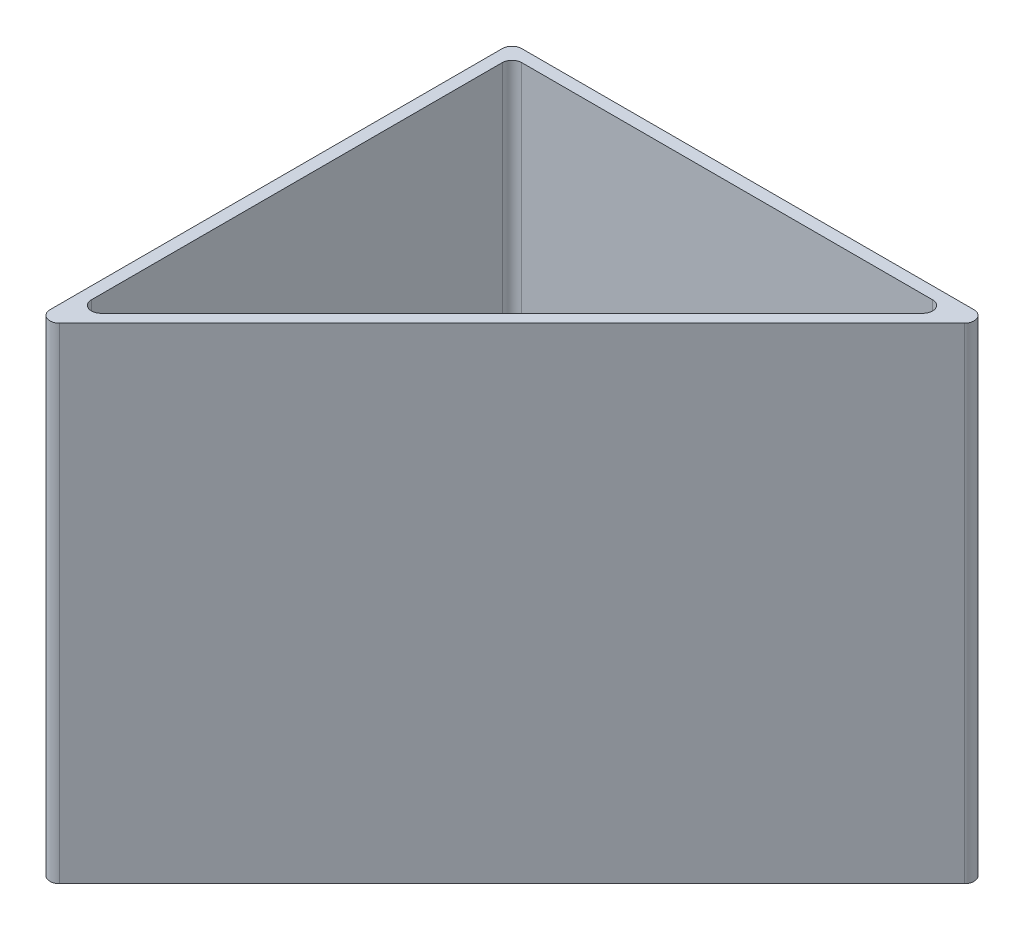
from build123d import *

# Parameters (mm, degrees)
BOSS_EXTRUDE1_DEPTH         = 100
SHELL1_T                    = -2.5
TAP_DRILL_FOR_M5X0_8_TAP1_D = 4.2
FILLET1_R                   = 2


with BuildPart() as part:
    # Sketch1 → Boss-Extrude1 (new body)
    with BuildSketch(Plane(origin=(0, 0, 0), x_dir=(1, 0, 0), z_dir=(0, 1, 0))):
        Polygon((0, 0), (0, -100), (100, 0), align=None)
    extrude(amount=BOSS_EXTRUDE1_DEPTH)

    # Shell1
    shell1_openings = [part.faces().sort_by_distance(p)[0] for p in [
        (33.333333333, 100, 33.333333333),
    ]]
    offset(amount=SHELL1_T, openings=shell1_openings, kind=Kind.INTERSECTION)

    # Tap Drill for M5x0.8 Tap1 (through all)
    with Locations(Plane(origin=(14.142135624, 2.5, 14.142135624), x_dir=(0, 0, 1), z_dir=(0, 1, 0))):
        with Locations((0, 0), (43.431457505, 0), (0, 43.431457505)):
            Hole(TAP_DRILL_FOR_M5X0_8_TAP1_D / 2)

    # Fillet1
    fillet1_edges = [part.edges().sort_by_distance(p)[0] for p in [
        (93.964466094, 51.25, 2.5),
        (2.5, 51.25, 2.5),
        (2.5, 51.25, 93.964466094),
        (100, 50, 0),
        (0, 50, 100),
        (0, 50, 0),
    ]]
    fillet(fillet1_edges, radius=FILLET1_R)


solid = part.part
